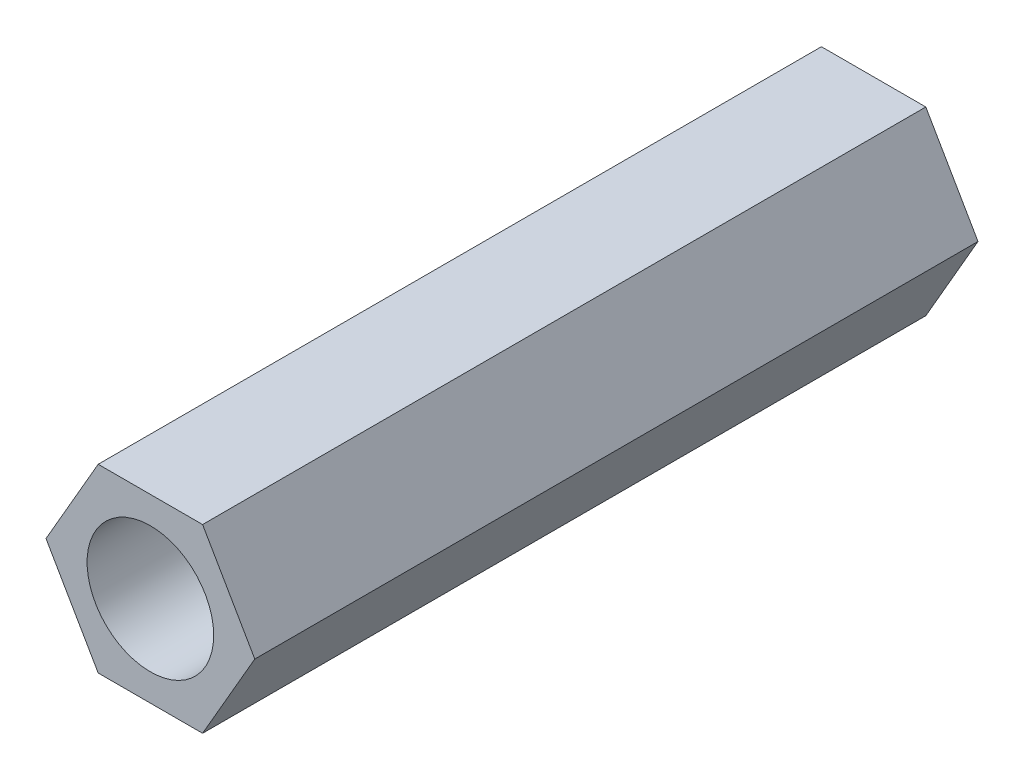
from build123d import *

# Parameters (mm, degrees)
BOSS_EXTRUDE1_DEPTH          = 40
SKETCH2_R                    = 3.5
CUT_EXTRUDE1_DEPTH           = 15
F_8_0_8_DIAMETER_HOLE1_D     = 8
F_8_0_8_DIAMETER_HOLE1_DEPTH = 15
F_8_0_8_DIAMETER_HOLE1_TIP   = 2.403442476


with BuildPart() as part:
    # Sketch1 → Boss-Extrude1 (new body)
    with BuildSketch(Plane.XY):
        Polygon((5.773502692, 0), (2.886751346, 5), (-2.886751346, 5), (-5.773502692, 0), (-2.886751346, -5), (2.886751346, -5), align=None)
    extrude(amount=BOSS_EXTRUDE1_DEPTH)

    # Sketch2 → Cut-Extrude1 (cut)
    with BuildSketch(Plane.XY.offset(40)):
        Circle(SKETCH2_R)
    extrude(amount=-CUT_EXTRUDE1_DEPTH, mode=Mode.SUBTRACT)

    # Ø8.0 (8) Diameter Hole1
    with Locations(Plane(origin=(0, 0, 0), x_dir=(-1, 0, 0), z_dir=(0, 0, -1))):
        with Locations((0, 0)):
            Hole(F_8_0_8_DIAMETER_HOLE1_D / 2, depth=F_8_0_8_DIAMETER_HOLE1_DEPTH)
            with Locations((0, 0, -(F_8_0_8_DIAMETER_HOLE1_DEPTH + F_8_0_8_DIAMETER_HOLE1_TIP / 2))):  # 118° drill point
                Cone(0, F_8_0_8_DIAMETER_HOLE1_D / 2, F_8_0_8_DIAMETER_HOLE1_TIP, mode=Mode.SUBTRACT)


solid = part.part
